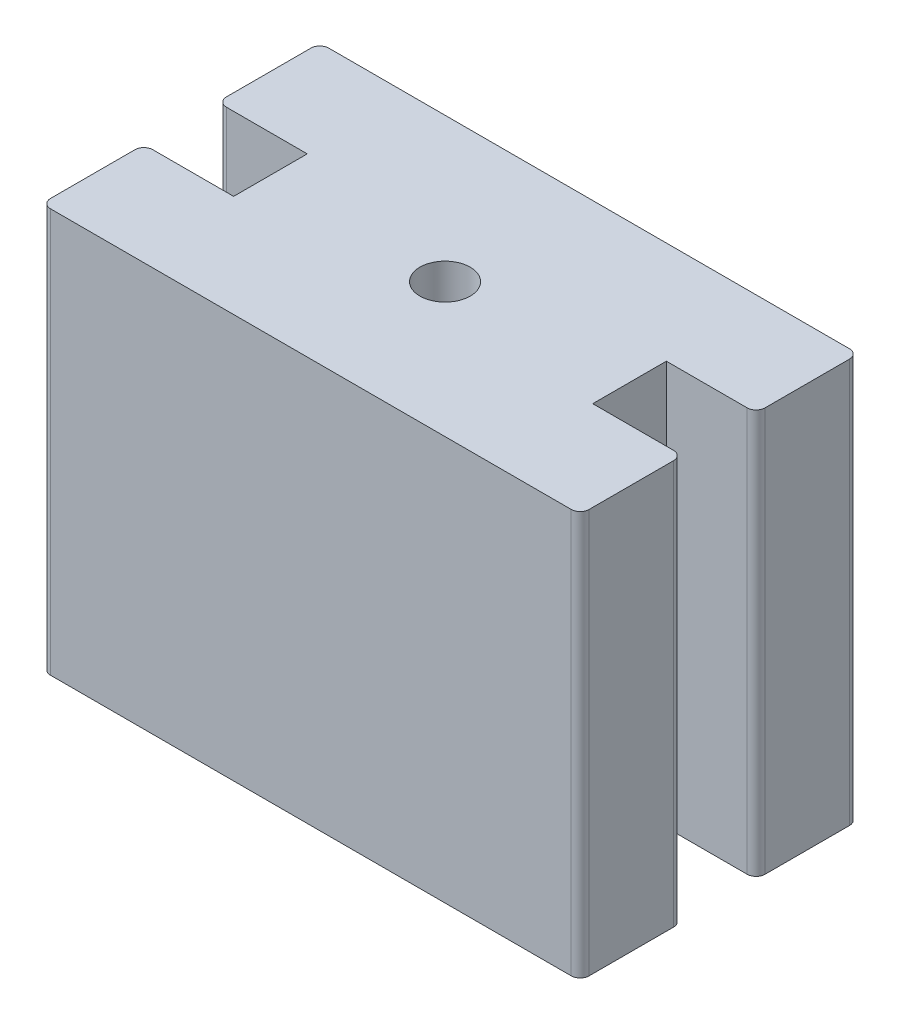
from build123d import *

# Parameters (mm, degrees)
SKETCH1_R           = 2.8
BOSS_EXTRUDE1_DEPTH = 45


with BuildPart() as part:
    # Sketch1 → Boss-Extrude1 (new body)
    with BuildSketch(Plane(origin=(0, 0, 0), x_dir=(1, 0, 0), z_dir=(0, 1, 0))):
        with BuildLine():
            Line((20, -3.55), (20, 4.65))
            Line((20, 4.65), (29, 4.65))
            ThreePointArc((29, 4.65), (29.707106781, 4.942893219), (30, 5.65))
            Line((30, 5.65), (30, 15.05))
            ThreePointArc((30, 15.05), (29.707106781, 15.757106781), (29, 16.05))
            Line((29, 16.05), (20, 16.05))
            Line((20, 16.05), (-20, 16.05))
            Line((-20, 16.05), (-29, 16.05))
            ThreePointArc((-29, 16.05), (-29.707106781, 15.757106781), (-30, 15.05))
            Line((-30, 15.05), (-30, 5.65))
            ThreePointArc((-30, 5.65), (-29.707106781, 4.942893219), (-29, 4.65))
            Line((-29, 4.65), (-20, 4.65))
            Line((-20, 4.65), (-20, -3.55))
            Line((-20, -3.55), (-29, -3.55))
            ThreePointArc((-29, -3.55), (-29.707106781, -3.842893219), (-30, -4.55))
            Line((-30, -4.55), (-30, -13.95))
            ThreePointArc((-30, -13.95), (-29.707106781, -14.657106781), (-29, -14.95))
            Line((-29, -14.95), (-20, -14.95))
            Line((-20, -14.95), (20, -14.95))
            Line((20, -14.95), (29, -14.95))
            ThreePointArc((29, -14.95), (29.707106781, -14.657106781), (30, -13.95))
            Line((30, -13.95), (30, -4.55))
            ThreePointArc((30, -4.55), (29.707106781, -3.842893219), (29, -3.55))
            Line((29, -3.55), (20, -3.55))
        make_face()
        with Locations(Location((0, 0, 0), (0, 0, 90))):
            Circle(SKETCH1_R, mode=Mode.SUBTRACT)
    extrude(amount=BOSS_EXTRUDE1_DEPTH)


solid = part.part
